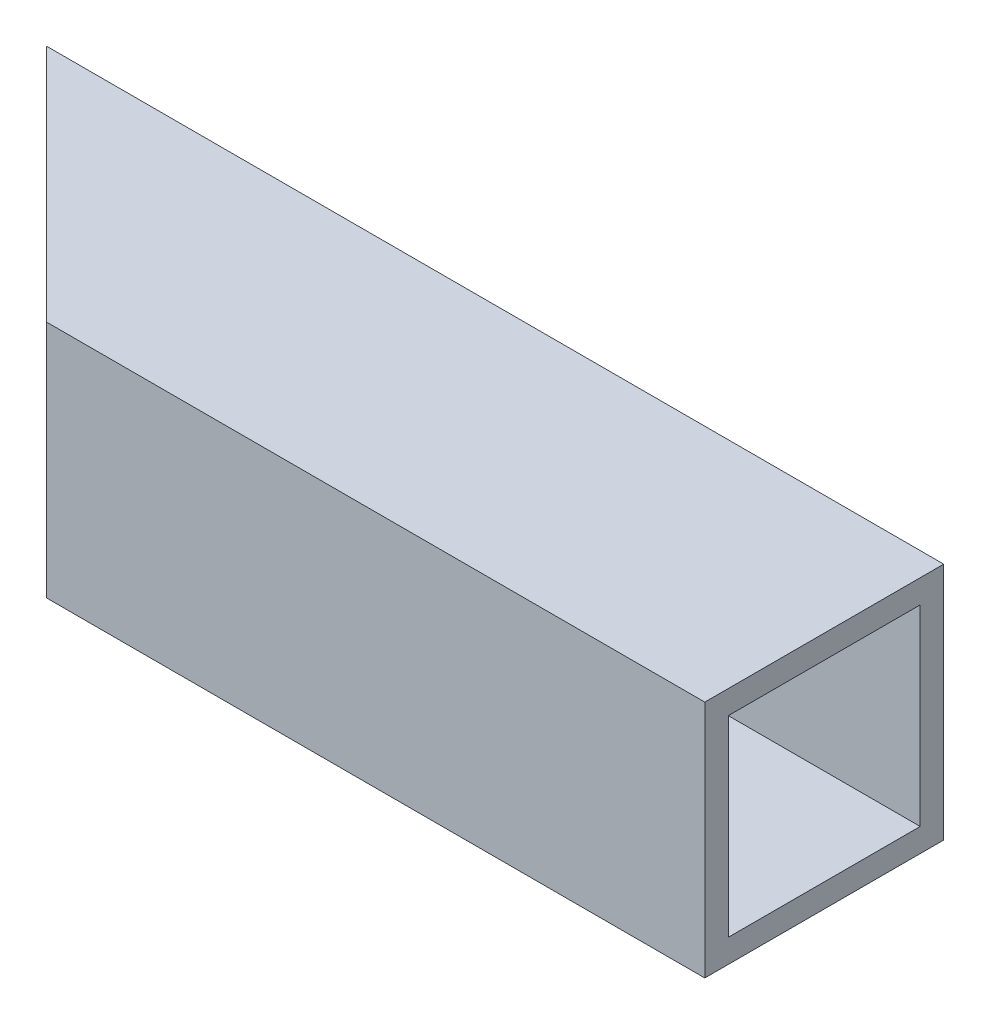
from build123d import *

# Parameters (mm, degrees)
SKETCH2_W           = 25.4
SKETCH2_H           = 25.4
SKETCH2_W_2         = 20.4
SKETCH2_H_2         = 20.4
BOSS_EXTRUDE1_DEPTH = 95.4
CUT_EXTRUDE1_DEPTH  = 100.536978053


with BuildPart() as part:
    # Sketch2 → Boss-Extrude1 (new body)
    with BuildSketch(Plane(origin=(0, 0, 0), x_dir=(0, 0, -1), z_dir=(1, 0, 0))):
        Rectangle(SKETCH2_W, SKETCH2_H)
        Rectangle(SKETCH2_W_2, SKETCH2_H_2, mode=Mode.SUBTRACT)
    extrude(amount=BOSS_EXTRUDE1_DEPTH)

    # Sketch3 → Cut-Extrude1 (cut, through all)
    with BuildSketch(Plane(origin=(0, 12.7, 0), x_dir=(1, 0, 0), z_dir=(0, 1, 0))):
        Polygon((0, -12.7), (0, 12.7), (25.4, -12.7), align=None)
    extrude(amount=-CUT_EXTRUDE1_DEPTH, mode=Mode.SUBTRACT)


solid = part.part
